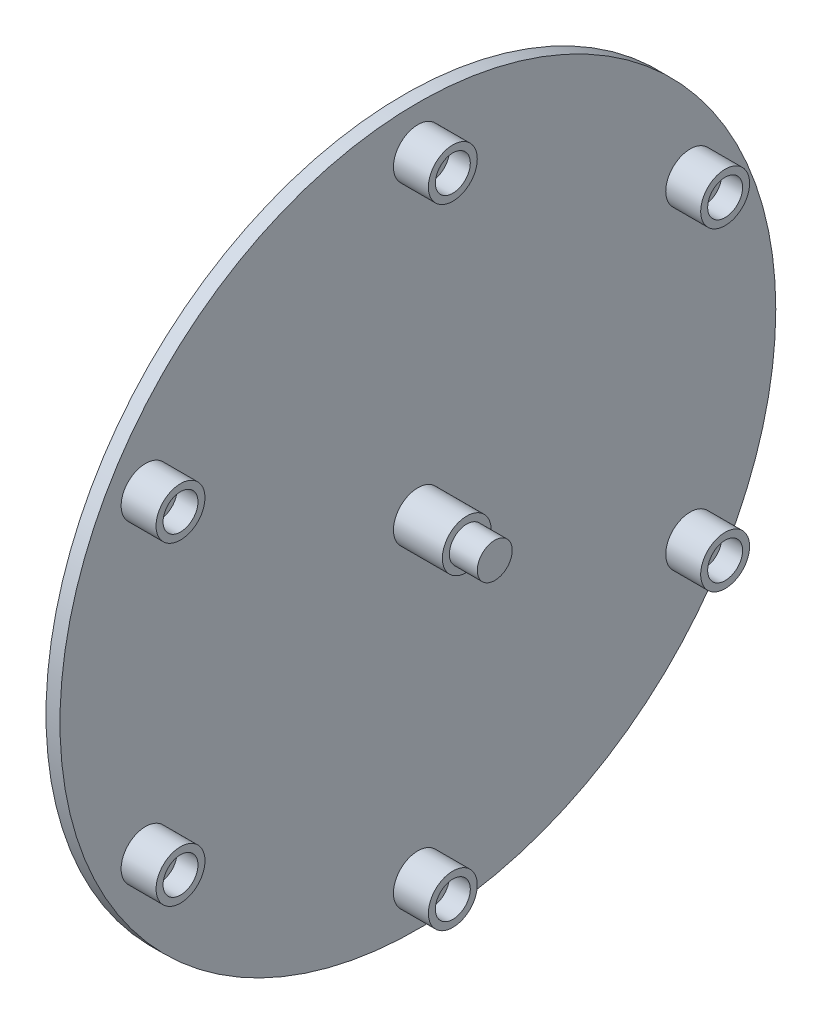
from build123d import *

# Parameters (mm, degrees)
SKETCH_1_R               = 51.220940725
EXTRUDE_1_DEPTH          = 2
SKETCH_2_R               = 3.5
EXTRUDE_2_DEPTH          = 5
PATTERN_CIRCULAR_1_COUNT = 6
SKETCH_3_R               = 2.5
CUT_EXTRUDE_1_DEPTH      = 3
PATTERN_CIRCULAR_2_COUNT = 6
SKETCH_4_R               = 2.5
EXTRUDE_3_DEPTH          = 11
SKETCH_5_R               = 3.5
EXTRUDE_4_DEPTH          = 7
SKETCH_6_R               = 5
EXTRUDE_5_DEPTH          = 20
SKETCH_7_R               = 6
EXTRUDE_6_DEPTH          = 5
SKETCH_8_R               = 2.5
CUT_EXTRUDE_2_DEPTH      = 7


with BuildPart() as part:
    # 草图1 → 凸台-拉伸1 (new body)
    with BuildSketch(Plane(origin=(0, 0, 0), x_dir=(0, 0, -1), z_dir=(1, 0, 0))):
        Circle(SKETCH_1_R)
    extrude(amount=EXTRUDE_1_DEPTH)

    # 草图2 → 凸台-拉伸2 (add)
    with BuildSketch(Plane(origin=(2, 0, 0), x_dir=(0, 0, -1), z_dir=(1, 0, 0))):
        with Locations((0, 45)):
            Circle(SKETCH_2_R)
    extrude_2 = extrude(amount=EXTRUDE_2_DEPTH)

    # 阵列(圆周)1: 凸台-拉伸2 ×6 about axis
    pattern_circular_1_axis = Axis((0, 0, 0), (1, 0, 0))
    for i in range(1, PATTERN_CIRCULAR_1_COUNT):
        add(extrude_2.rotate(pattern_circular_1_axis, i * 360 / PATTERN_CIRCULAR_1_COUNT))

    # 草图3 → 切除-拉伸1 (cut)
    with BuildSketch(Plane(origin=(7, 0, 0), x_dir=(0, 0, -1), z_dir=(1, 0, 0))):
        with Locations((0, 45)):
            Circle(SKETCH_3_R)
    cut_extrude_1 = extrude(amount=-CUT_EXTRUDE_1_DEPTH, mode=Mode.SUBTRACT)

    # 阵列(圆周)2: 切除-拉伸1 ×6 about axis
    pattern_circular_2_axis = Axis((0, 0, 0), (1, 0, 0))
    for i in range(1, PATTERN_CIRCULAR_2_COUNT):
        add(cut_extrude_1.rotate(pattern_circular_2_axis, i * 360 / PATTERN_CIRCULAR_2_COUNT), mode=Mode.SUBTRACT)

    # 草图4 → 凸台-拉伸3 (add)
    with BuildSketch(Plane(origin=(2, 0, 0), x_dir=(0, 0, -1), z_dir=(1, 0, 0))):
        Circle(SKETCH_4_R)
    extrude(amount=EXTRUDE_3_DEPTH)

    # 草图5 → 凸台-拉伸4 (add)
    with BuildSketch(Plane(origin=(2, 0, 0), x_dir=(0, 0, -1), z_dir=(1, 0, 0))):
        Circle(SKETCH_5_R)
    extrude(amount=EXTRUDE_4_DEPTH)

    # 草图6 → 凸台-拉伸5 (add)
    with BuildSketch(Plane.ZY):
        with Locations(Location((0, 0, 0), (0, 0, 180))):
            Circle(SKETCH_6_R)
    extrude(amount=EXTRUDE_5_DEPTH)

    # 草图7 → 凸台-拉伸6 (add)
    with BuildSketch(Plane.ZY):
        with Locations(Location((0, 0, 0), (0, 0, 180))):
            Circle(SKETCH_7_R)
    extrude(amount=EXTRUDE_6_DEPTH)

    # 草图8 → 切除-拉伸2 (cut)
    with BuildSketch(Plane.ZY.offset(20)):
        with Locations(Location((0, 0, 0), (0, 0, 180))):
            Circle(SKETCH_8_R)
    extrude(amount=-CUT_EXTRUDE_2_DEPTH, mode=Mode.SUBTRACT)


solid = part.part
